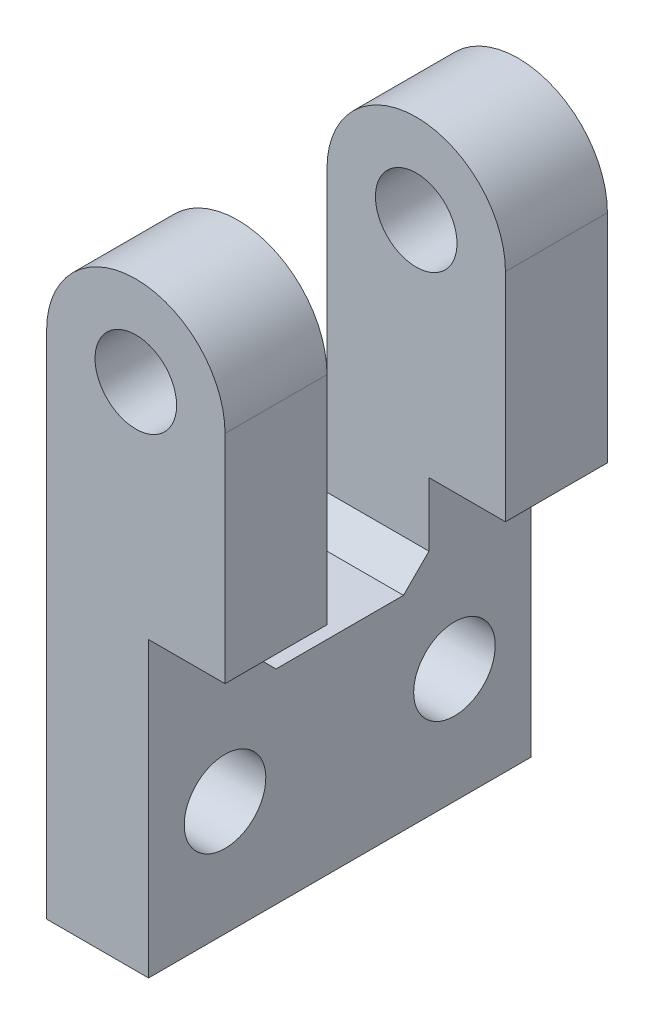
from build123d import *

# Parameters (mm, degrees)
SKETCH_1_R          = 1.6
EXTRUDE_1_DEPTH     = 15
SKETCH_3_W          = 7
SKETCH_3_H          = 18.899287815
CUT_EXTRUDE_2_DEPTH = 26.961509971
SKETCH_4_W          = 3
SKETCH_4_H          = 17
CUT_EXTRUDE_3_DEPTH = 26.243811123
SKETCH_5_R          = 1.6
CUT_EXTRUDE_4_DEPTH = 10
CHAMFER_1_SIZE      = 1


with BuildPart() as part:
    # 草图1 → 凸台-拉伸1 (new body)
    with BuildSketch(Plane.XY):
        with BuildLine():
            Line((-3.5, -20), (-3.5, 0))
            ThreePointArc((-3.5, 0), (0, 3.5), (3.5, 0))
            Line((3.5, 0), (3.5, -20))
            Line((3.5, -20), (-3.5, -20))
        make_face()
        Circle(SKETCH_1_R, mode=Mode.SUBTRACT)
    extrude(amount=EXTRUDE_1_DEPTH)

    # 草图3 → 切除-拉伸2 (cut, through all)
    with BuildSketch(Plane.ZY.offset(3.5)):
        with Locations((7.5, -2.550356092)):
            Rectangle(SKETCH_3_W, SKETCH_3_H)
    extrude(amount=-CUT_EXTRUDE_2_DEPTH, mode=Mode.SUBTRACT)

    # 草图4 → 切除-拉伸3 (cut, through all)
    with BuildSketch(Plane(origin=(0, 0, 0), x_dir=(-1, 0, 0), z_dir=(0, 0, -1))):
        with Locations((-2, -17)):
            Rectangle(SKETCH_4_W, SKETCH_4_H)
    extrude(amount=-CUT_EXTRUDE_3_DEPTH, mode=Mode.SUBTRACT)

    # 草图5 → 切除-拉伸4 (cut)
    with BuildSketch(Plane.ZY.offset(3.5)):
        with Locations(Location((12, -15.5, 0), (0, 0, 270))):
            Circle(SKETCH_5_R)
        with Locations(Location((3, -15.5, 0), (0, 0, 270))):
            Circle(SKETCH_5_R)
    extrude(amount=-CUT_EXTRUDE_4_DEPTH, mode=Mode.SUBTRACT)

    # 倒角1
    chamfer_1_edges = [part.edges().sort_by_distance(p)[0] for p in [
        (-1.5, -12, 11),
        (-1.5, -12, 4),
    ]]
    chamfer(chamfer_1_edges, length=CHAMFER_1_SIZE)


solid = part.part
